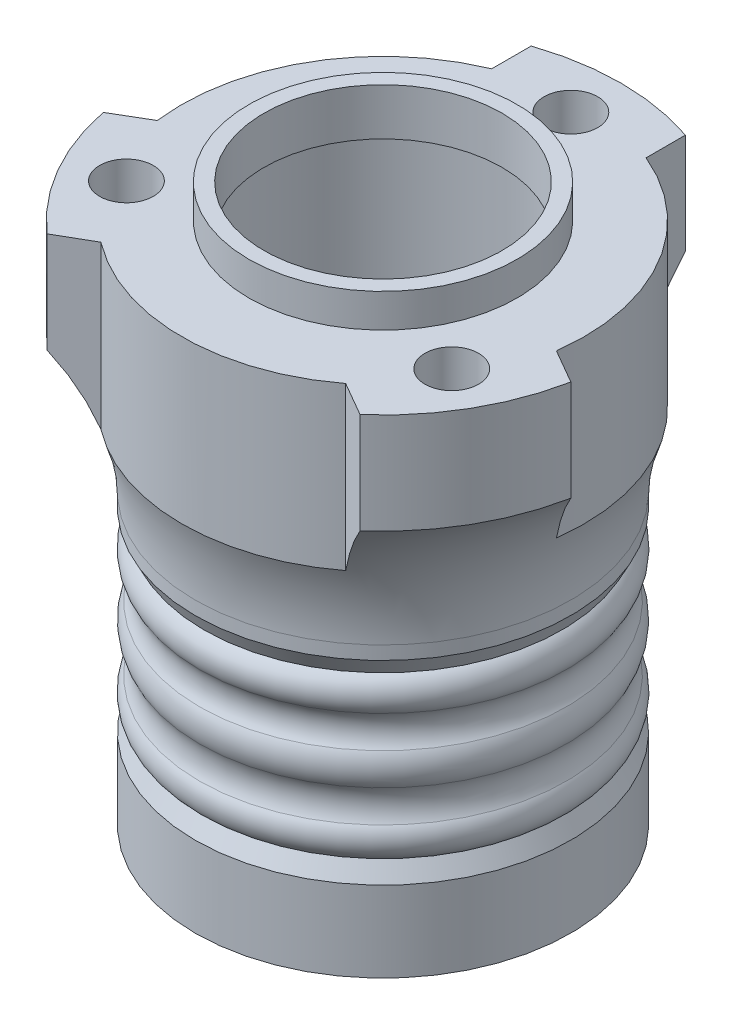
from build123d import *

# Parameters (mm, degrees)
SKETCH2_OUTSIDE_W       = 99.054
SKETCH2_OUTSIDE_H       = 99.054
SKETCH2_OUTSIDE_R       = 20
CUT_EXTRUDE1_DEPTH      = 5
CUT_EXTRUDE2_DEPTH      = 98.002577285
CUT_EXTRUDE2_DEPTH_BACK = 7
SKETCH3_R               = 17.75
CUT_EXTRUDE3_DEPTH      = 40
SKETCH5_R               = 4
CUT_EXTRUDE4_DEPTH      = 10
SKETCH6_R               = 21
CUT_EXTRUDE6_DEPTH      = 76


with BuildPart() as part:
    # Sketch1 → Revolve1 (revolve)
    with BuildSketch(Plane.XY, mode=Mode.PRIVATE) as revolve1_sk:
        with BuildLine():
            Line((0, -83), (28, -83))
            Line((28, -83), (28, -71))
            Line((28, -71), (26.7, -68.5))
            ThreePointArc((26.7, -68.5), (28, -66.23203125), (27.35, -63.7))
            ThreePointArc((27.35, -63.7), (26.7, -61.3), (27.35, -58.9))
            ThreePointArc((27.35, -58.9), (28, -56.5), (27.35, -54.1))
            ThreePointArc((27.35, -54.1), (26.558436035, -51.7), (27.35, -49.3))
            ThreePointArc((27.35, -49.3), (28, -46.76796875), (26.7, -44.5))
            Line((26.7, -44.5), (28, -42))
            Line((28, -42), (28, -40))
            ThreePointArc((28, -40), (29.936654182, -29.319995318), (35.5, -20))
            Line((35.5, -20), (35.5, 0))
            Line((35.5, 0), (0, 0))
            Line((0, 0), (0, -83))
        make_face()
    revolve(revolve1_sk.sketch.rotate(Axis((0, 0, 0), (0, -1, 0)), 90), axis=Axis((0, 0, 0), (0, -1, 0)))

    # Sketch2 outside → Cut-Extrude1 (cut)
    with BuildSketch(Plane(origin=(0, 0, 0), x_dir=(1, 0, 0), z_dir=(0, 1, 0))):
        Rectangle(SKETCH2_OUTSIDE_W, SKETCH2_OUTSIDE_H)
        with Locations(Location((0, 0, 0), (0, 0, 270))):
            Circle(SKETCH2_OUTSIDE_R, mode=Mode.SUBTRACT)
    extrude(amount=-CUT_EXTRUDE1_DEPTH, mode=Mode.SUBTRACT)

    # Sketch3 → Cut-Extrude2 (cut, two sides: drawn at the far end of the back side and taken through both)
    with BuildSketch(Plane(origin=(0, 0, 0), x_dir=(1, 0, 0), z_dir=(0, 1, 0)).offset(-CUT_EXTRUDE2_DEPTH_BACK)):
        with Locations(Location((0, 0, 0), (0, 0, 90))):
            Circle(SKETCH3_R)
    extrude(amount=CUT_EXTRUDE2_DEPTH + CUT_EXTRUDE2_DEPTH_BACK, mode=Mode.SUBTRACT)

    # Sketch4 → Cut-Extrude3 (cut)
    with BuildSketch(Plane(origin=(0, -5, 0), x_dir=(1, 0, 0), z_dir=(0, 1, 0))):
        with BuildLine():
            Line((-11.5, 27.708302005), (-11.5, 36.893569163))
            ThreePointArc((-11.5, 36.893569163), (-38.452583445, 21.587967058), (-39.116292786, -9.400138727))
            Line((-39.116292786, -9.400138727), (-29.746093432, -3.894858859))
            ThreePointArc((-29.746093432, -3.894858859), (-25.980762114, 15), (-11.5, 27.708302005))
        make_face()
        with BuildLine():
            Line((11.5, 27.708302005), (11.5, 36.893569163))
            Line((11.5, 36.893569163), (28.492131838, 31.542661949))
            Line((28.492131838, 31.542661949), (37.637433316, 13.990056046))
            Line((37.637433316, 13.990056046), (44.445273929, 4.335643403))
            Line((44.445273929, 4.335643403), (37.637433316, -8.052167996))
            Line((37.637433316, -8.052167996), (34.836079144, -6.83356348))
            Line((34.836079144, -6.83356348), (29.746093432, -3.894858859))
            ThreePointArc((29.746093432, -3.894858859), (25.980762114, 15), (11.5, 27.708302005))
        make_face()
        with BuildLine():
            Line((-18.246093432, -23.813443146), (-23.336079144, -26.752147767))
            Line((-23.336079144, -26.752147767), (-24.985631262, -28.64317075))
            Line((-24.985631262, -28.64317075), (-15.892945892, -35.329052408))
            Line((-15.892945892, -35.329052408), (-5.348602182, -38.036383901))
            Line((-5.348602182, -38.036383901), (8.188055284, -38.036383901))
            Line((8.188055284, -38.036383901), (20.43638373, -32.98577886))
            Line((20.43638373, -32.98577886), (24.324755582, -27.697659259))
            Line((24.324755582, -27.697659259), (23.336079144, -26.752147767))
            Line((23.336079144, -26.752147767), (18.246093432, -23.813443146))
            ThreePointArc((18.246093432, -23.813443146), (0, -30), (-18.246093432, -23.813443146))
        make_face()
    extrude(amount=-CUT_EXTRUDE3_DEPTH, mode=Mode.SUBTRACT)

    # Sketch5 → Cut-Extrude4 (cut)
    with BuildSketch(Plane(origin=(0, -5, 0), x_dir=(1, 0, 0), z_dir=(0, 1, 0))):
        with Locations(Location((0, 28, 0), (0, 0, 270))):
            Circle(SKETCH5_R)
        with Locations(Location((24.248711306, -14, 0), (0, 0, 270))):
            Circle(SKETCH5_R)
        with Locations(Location((-24.248711306, -14, 0), (0, 0, 270))):
            Circle(SKETCH5_R)
    extrude(amount=-CUT_EXTRUDE4_DEPTH, mode=Mode.SUBTRACT)

    # Sketch6 → Cut-Extrude6 (cut)
    with BuildSketch(Plane.XZ.offset(83)):
        with Locations(Location((0, 0, 0), (0, 0, 270))):
            Circle(SKETCH6_R)
    extrude(amount=-CUT_EXTRUDE6_DEPTH, mode=Mode.SUBTRACT)


solid = part.part
